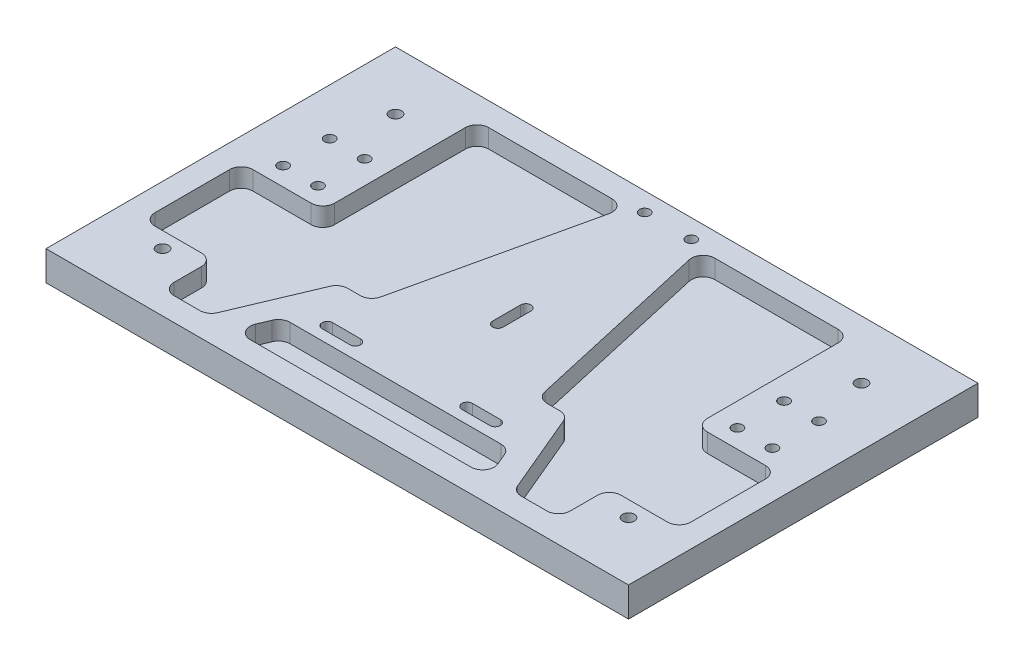
from build123d import *

# Parameters (mm, degrees)
SKETCH1_W                                           = 250
SKETCH1_H                                           = 149.999999994
BOSS_EXTRUDE1_DEPTH                                 = 12.7
CBORE_FOR_8_BINDING_HEAD_MACHINE_SCREW1_D           = 4.4958
CBORE_FOR_8_BINDING_HEAD_MACHINE_SCREW1_CBORE_D     = 9.525
CBORE_FOR_8_BINDING_HEAD_MACHINE_SCREW1_CBORE_DEPTH = 4.445
F_1_4_20_TAPPED_HOLE1_D                             = 5.1054
CUT_EXTRUDE1_DEPTH                                  = 8
FILLET1_R                                           = 4.999999906
FILLET1_OF_MIRROR1_R                                = 4.999999906
CUT_EXTRUDE3_DEPTH                                  = 8
FILLET3_R                                           = 4.999999906
CUT_EXTRUDE4_DEPTH                                  = 147.325971719
CUT_EXTRUDE5_DEPTH                                  = 4.445


with BuildPart() as part:
    # Sketch1 → Boss-Extrude1 (new body)
    with BuildSketch(Plane(origin=(0, 0, 0), x_dir=(1, 0, 0), z_dir=(0, 1, 0))):
        Rectangle(SKETCH1_W, SKETCH1_H)
    extrude(amount=BOSS_EXTRUDE1_DEPTH)

    # CBORE for #8 Binding Head Machine Screw1 (through all)
    with Locations(Plane.XZ):
        with Locations((-30, 43.249999997), (30, 43.249999997), (0, 0.069999997), (-105, -26.750000003), (-90, -26.750000003), (-90, -6.750000003), (-105, -6.750000003), (-10, -66.929999703), (10, -66.929999703)):
            cbore_for_8_binding_head_machine_screw1 = CounterBoreHole(CBORE_FOR_8_BINDING_HEAD_MACHINE_SCREW1_D / 2, CBORE_FOR_8_BINDING_HEAD_MACHINE_SCREW1_CBORE_D / 2, CBORE_FOR_8_BINDING_HEAD_MACHINE_SCREW1_CBORE_DEPTH)

    # 1/4-20 Tapped Hole1 (through all)
    with Locations(Plane.XZ):
        with Locations((100, -49.999999997), (-100, -49.999999997), (-100, 49.999999997), (100, 49.999999997)):
            Hole(F_1_4_20_TAPPED_HOLE1_D / 2)

    # Sketch10 → Cut-Extrude1 (cut)
    with BuildSketch(Plane(origin=(0, 12.7, 0), x_dir=(1, 0, 0), z_dir=(0, 1, 0))):
        Polygon((-80, 64.999999997), (-80, -1.200000003), (-115, -1.200000003), (-115, -43.249999997), (-85, -43.249999997), (-85, -64.999999997), (-65.655144454, -64.999999997), (-48.8, -24.999999997), (-36.1, -24.999999997), (-15.78, 64.999999997), align=None)
    cut_extrude1 = extrude(amount=-CUT_EXTRUDE1_DEPTH, mode=Mode.SUBTRACT)

    # Fillet1
    fillet1_edges = [part.edges().sort_by_distance(p)[0] for p in [
        (-15.78, 8.7, -64.999999997),
        (-36.1, 8.7, 24.999999997),
        (-48.8, 8.7, 24.999999997),
        (-65.655144454, 8.7, 64.999999997),
        (-85, 8.7, 64.999999997),
        (-85, 8.7, 43.249999997),
        (-115, 8.7, 43.249999997),
        (-115, 8.7, 1.200000003),
        (-80, 8.7, 1.200000003),
        (-80, 8.7, -64.999999997),
    ]]
    fillet(fillet1_edges, radius=FILLET1_R)

    # Mirror1: Cut-Extrude1 across plane
    add(cut_extrude1.mirror(Plane(origin=(0, 0, 0), x_dir=(0, 0, 1), z_dir=(1, 0, 0))), mode=Mode.SUBTRACT)

    # Fillet1 of Mirror1
    fillet1_of_mirror1_edges = [part.edges().sort_by_distance(p)[0] for p in [
        (15.78, 8.7, -64.999999997),
        (36.1, 8.7, 24.999999997),
        (48.8, 8.7, 24.999999997),
        (65.655144454, 8.7, 64.999999997),
        (85, 8.7, 64.999999997),
        (85, 8.7, 43.249999997),
        (115, 8.7, 43.249999997),
        (115, 8.7, 1.200000003),
        (80, 8.7, 1.200000003),
        (80, 8.7, -64.999999997),
    ]]
    fillet(fillet1_of_mirror1_edges, radius=FILLET1_OF_MIRROR1_R)

    # Sketch14 → Cut-Extrude3 (cut)
    with BuildSketch(Plane(origin=(0, 12.7, 0), x_dir=(1, 0, 0), z_dir=(0, 1, 0))):
        Polygon((-54.905605596, -64.999999997), (54.905605596, -64.999999997), (48.584926426, -49.999999997), (-48.584926426, -49.999999997), align=None)
    extrude(amount=-CUT_EXTRUDE3_DEPTH, mode=Mode.SUBTRACT)

    # Fillet3
    fillet3_edges = [part.edges().sort_by_distance(p)[0] for p in [
        (-54.905605596, 8.7, 64.999999997),
        (-48.584926426, 8.7, 49.999999997),
        (48.584926426, 8.7, 49.999999997),
        (54.905605596, 8.7, 64.999999997),
    ]]
    fillet(fillet3_edges, radius=FILLET3_R)

    # Sketch15 → Cut-Extrude4 (cut, through all)
    with BuildSketch(Plane(origin=(0, 12.7, 0), x_dir=(1, 0, 0), z_dir=(0, 1, 0))):
        with BuildLine():
            Line((-36, -41.002099997), (-24, -41.002099997))
            ThreePointArc((-24, -41.002099997), (-21.7521, -43.249999997), (-24, -45.497899997))
            Line((-24, -45.497899997), (-36, -45.497899997))
            ThreePointArc((-36, -45.497899997), (-38.2479, -43.249999997), (-36, -41.002099997))
        make_face()
        with BuildLine():
            Line((24, -41.002099997), (36, -41.002099997))
            ThreePointArc((36, -41.002099997), (38.2479, -43.249999997), (36, -45.497899997))
            Line((36, -45.497899997), (24, -45.497899997))
            ThreePointArc((24, -45.497899997), (21.7521, -43.249999997), (24, -41.002099997))
        make_face()
        with BuildLine():
            Line((2.2479, 5.930000003), (2.2479, -6.069999997))
            ThreePointArc((2.2479, -6.069999997), (0, -8.317899997), (-2.2479, -6.069999997))
            Line((-2.2479, -6.069999997), (-2.2479, 5.930000003))
            ThreePointArc((-2.2479, 5.930000003), (0, 8.177900003), (2.2479, 5.930000003))
        make_face()
    extrude(amount=-CUT_EXTRUDE4_DEPTH, mode=Mode.SUBTRACT)

    # Sketch16 → Cut-Extrude5 (cut)
    with BuildSketch(Plane.XZ):
        with BuildLine():
            Line((-4.7625, -6), (-4.7625, 6))
            ThreePointArc((-4.7625, 6), (0, 10.7625), (4.7625, 6))
            Line((4.7625, 6), (4.7625, -6))
            ThreePointArc((4.7625, -6), (0, -10.7625), (-4.7625, -6))
        make_face()
        with BuildLine():
            Line((36, 38.487499997), (24, 38.487499997))
            ThreePointArc((24, 38.487499997), (19.2375, 43.249999997), (24, 48.012499997))
            Line((24, 48.012499997), (36, 48.012499997))
            ThreePointArc((36, 48.012499997), (40.7625, 43.249999997), (36, 38.487499997))
        make_face()
        with BuildLine():
            Line((-24, 38.487499997), (-36, 38.487499997))
            ThreePointArc((-36, 38.487499997), (-40.7625, 43.249999997), (-36, 48.012499997))
            Line((-36, 48.012499997), (-24, 48.012499997))
            ThreePointArc((-24, 48.012499997), (-19.2375, 43.249999997), (-24, 38.487499997))
        make_face()
    extrude(amount=-CUT_EXTRUDE5_DEPTH, mode=Mode.SUBTRACT)

    # Mirror3: CBORE for #8 Binding Head Machine Screw1 across plane
    add(cbore_for_8_binding_head_machine_screw1.mirror(Plane(origin=(0, 0, 0), x_dir=(0, 0, 1), z_dir=(1, 0, 0))), mode=Mode.SUBTRACT)


solid = part.part
